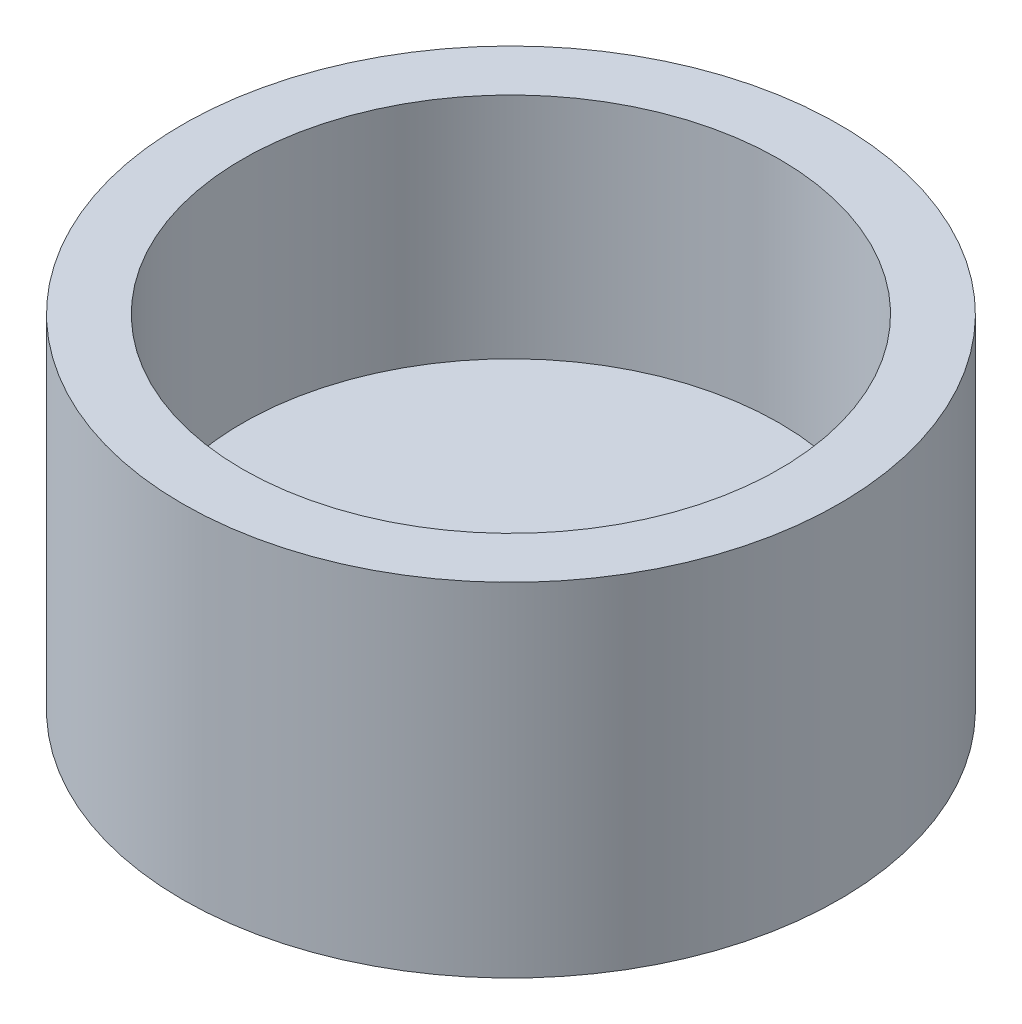
from build123d import *

# Parameters (mm, degrees)
SKETCH1_R           = 5.75
BOSS_EXTRUDE1_DEPTH = 6
SKETCH2_R           = 4.7
CUT_EXTRUDE1_DEPTH  = 4


with BuildPart() as part:
    # Sketch1 → Boss-Extrude1 (new body)
    with BuildSketch(Plane(origin=(0, 0, 0), x_dir=(1, 0, 0), z_dir=(0, 1, 0))):
        with Locations(Location((0, 0, 0), (0, 0, 270))):
            Circle(SKETCH1_R)
    extrude(amount=BOSS_EXTRUDE1_DEPTH)

    # Sketch2 → Cut-Extrude1 (cut)
    with BuildSketch(Plane(origin=(0, 6, 0), x_dir=(1, 0, 0), z_dir=(0, 1, 0))):
        with Locations(Location((0, 0, 0), (0, 0, 270))):
            Circle(SKETCH2_R)
    extrude(amount=-CUT_EXTRUDE1_DEPTH, mode=Mode.SUBTRACT)


solid = part.part
